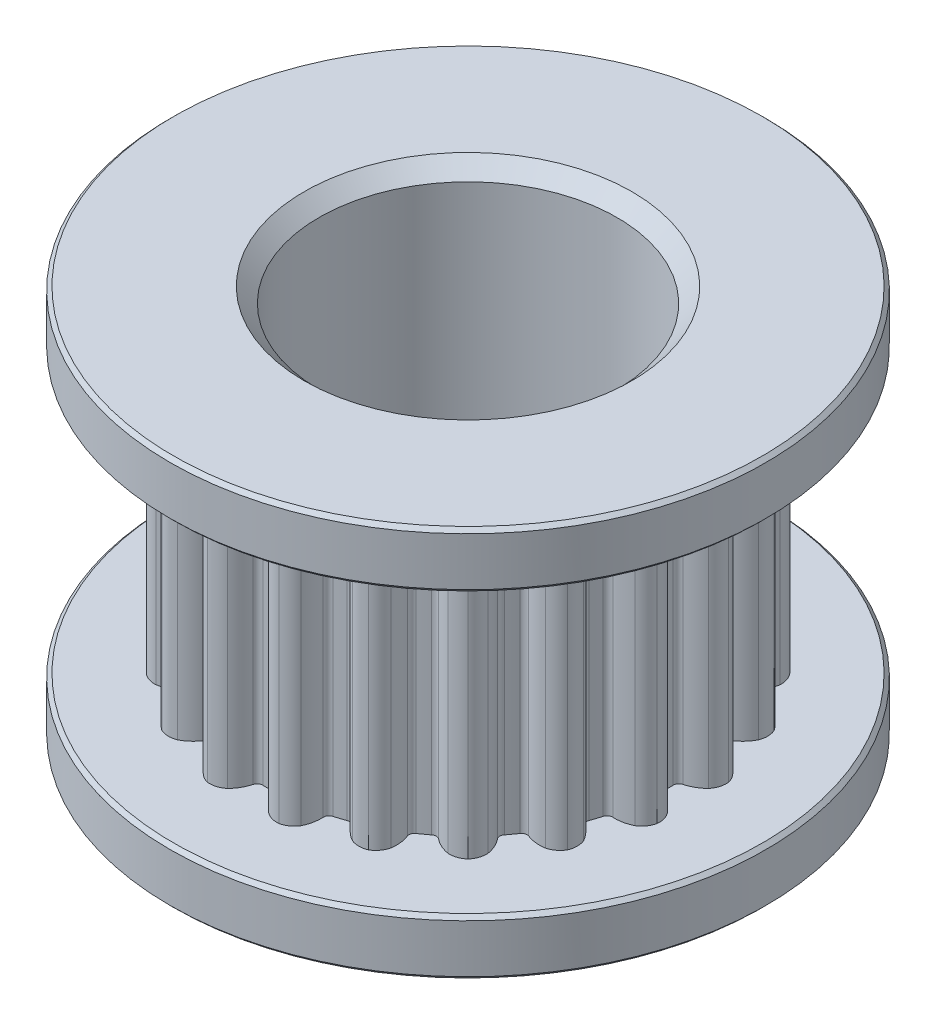
from build123d import *

# Parameters (mm, degrees)
THRUBORE_DEPTH               = 13.472469683
THRUBORE_DEPTH_BACK          = 13.472469683
THRUBORES_R                  = 4
GT2PROFILE_REACH             = 14.472
GT2PROFILE_DIRECTION_2_REACH = 14.472
GT2_GROOVE_CP_COUNT          = 20
INNERC_SIZE                  = 0.4
OUTERC_SIZE                  = 0.1


with BuildPart() as part:
    # BodyS → Body (revolve)
    with BuildSketch(Plane.XY, mode=Mode.PRIVATE) as body_sk:
        Polygon((6.11, -3.75), (6.11, 3.75), (8, 3.75), (8, 5.25), (4, 5.25), (4, 2.25), (3.5, 2.25), (3.5, -2.25), (4, -2.25), (4, -5.25), (8, -5.25), (8, -3.75), align=None)
    revolve(body_sk.sketch.rotate(Axis((0, 5.25, 0), (0, -1, 0)), 90), axis=Axis((0, 5.25, 0), (0, -1, 0)))

    # ThruBoreS → ThruBore (cut, two sides: drawn at the far end of the back side and taken through both)
    with BuildSketch(Plane(origin=(0, 0, 0), x_dir=(1, 0, 0), z_dir=(0, 1, 0)).offset(-THRUBORE_DEPTH_BACK)):
        with Locations(Location((0, 0, 0), (0, 0, 270))):
            Circle(THRUBORES_R)
    extrude(amount=THRUBORE_DEPTH + THRUBORE_DEPTH_BACK, mode=Mode.SUBTRACT)

    # GT2Profile: up to this face of the body (flat: up to its plane)
    gt2profile_end = Plane(part.part.faces().sort_by_distance((0, -3.75, -7.77372583))[0])
    # GT2ProfileS → GT2Profile (cut, up to the picked face)
    with BuildSketch(Plane(origin=(0, 0, 0), x_dir=(1, 0, 0), z_dir=(0, 1, 0)), mode=Mode.PRIVATE) as gt2profile_sk1:
        with BuildLine():
            ThreePointArc((0.299749921, -5.468781955), (0.244461347, -5.387479579), (0.150701934, -5.357881011))
            ThreePointArc((0.150701934, -5.357881011), (0, -5.36), (-0.150701934, -5.357881011))
            ThreePointArc((-0.150701934, -5.357881011), (-0.244461347, -5.387479579), (-0.299749921, -5.468781955))
            ThreePointArc((-0.299749921, -5.468781955), (-0.396626607, -5.703924717), (-0.549685833, -5.907025885))
            ThreePointArc((-0.549685833, -5.907025885), (-0.7593874, -6.016293358), (-0.995541542, -6.028349446))
            ThreePointArc((-0.995541542, -6.028349446), (0, -6.11), (0.995541542, -6.028349446))
            ThreePointArc((0.995541542, -6.028349446), (0.7593874, -6.016293358), (0.549685833, -5.907025885))
            ThreePointArc((0.549685833, -5.907025885), (0.396626607, -5.703924717), (0.299749921, -5.468781955))
        make_face()
    gt2profile_tool1 = split(extrude(gt2profile_sk1.sketch, amount=-GT2PROFILE_REACH, mode=Mode.PRIVATE), bisect_by=gt2profile_end, keep=Keep.BOTH, mode=Mode.PRIVATE)
    gt2profile = gt2profile_tool1.solids().sort_by(Axis((0, 0, 5.802237), (0, -1, 0)))[0]
    add(gt2profile, mode=Mode.SUBTRACT)

    # GT2Profile direction 2: up to this face of the body (flat: up to its plane)
    gt2profile_direction_2_end = Plane(part.part.faces().sort_by_distance((0, 3.75, -6.33627417))[0])
    # GT2ProfileS → GT2Profile direction 2 (cut, up to the picked face)
    with BuildSketch(Plane(origin=(0, 0, 0), x_dir=(1, 0, 0), z_dir=(0, 1, 0)), mode=Mode.PRIVATE) as gt2profile_direction_2_sk1:
        with BuildLine():
            ThreePointArc((0.299749921, -5.468781955), (0.244461347, -5.387479579), (0.150701934, -5.357881011))
            ThreePointArc((0.150701934, -5.357881011), (0, -5.36), (-0.150701934, -5.357881011))
            ThreePointArc((-0.150701934, -5.357881011), (-0.244461347, -5.387479579), (-0.299749921, -5.468781955))
            ThreePointArc((-0.299749921, -5.468781955), (-0.396626607, -5.703924717), (-0.549685833, -5.907025885))
            ThreePointArc((-0.549685833, -5.907025885), (-0.7593874, -6.016293358), (-0.995541542, -6.028349446))
            ThreePointArc((-0.995541542, -6.028349446), (0, -6.11), (0.995541542, -6.028349446))
            ThreePointArc((0.995541542, -6.028349446), (0.7593874, -6.016293358), (0.549685833, -5.907025885))
            ThreePointArc((0.549685833, -5.907025885), (0.396626607, -5.703924717), (0.299749921, -5.468781955))
        make_face()
    gt2profile_direction_2_tool1 = split(extrude(gt2profile_direction_2_sk1.sketch, amount=GT2PROFILE_DIRECTION_2_REACH, mode=Mode.PRIVATE), bisect_by=gt2profile_direction_2_end, keep=Keep.BOTH, mode=Mode.PRIVATE)
    gt2profile_direction_2 = gt2profile_direction_2_tool1.solids().sort_by(Axis((0, 0, 5.802237), (0, 1, 0)))[0]
    add(gt2profile_direction_2, mode=Mode.SUBTRACT)

    # GT2 Groove CP: GT2Profile, GT2Profile direction 2 ×20 about axis
    gt2_groove_cp_axis = Axis((0, 0, 0), (0, 1, 0))
    add([gt2profile.rotate(gt2_groove_cp_axis, i * 360 / GT2_GROOVE_CP_COUNT) for i in range(1, GT2_GROOVE_CP_COUNT)], mode=Mode.SUBTRACT)
    add([gt2profile_direction_2.rotate(gt2_groove_cp_axis, i * 360 / GT2_GROOVE_CP_COUNT) for i in range(1, GT2_GROOVE_CP_COUNT)], mode=Mode.SUBTRACT)

    # InnerC
    innerc_edges = [part.edges().sort_by_distance(p)[0] for p in [
        (0, -5.25, -4),
        (0, 5.25, -4),
    ]]
    chamfer(innerc_edges, length=INNERC_SIZE)

    # OuterC
    outerc_edges = [part.edges().sort_by_distance(p)[0] for p in [
        (0, 5.25, -8),
        (0, 3.75, -8),
        (0, -3.75, -8),
        (0, -5.25, -8),
    ]]
    chamfer(outerc_edges, length=OUTERC_SIZE)


solid = part.part
